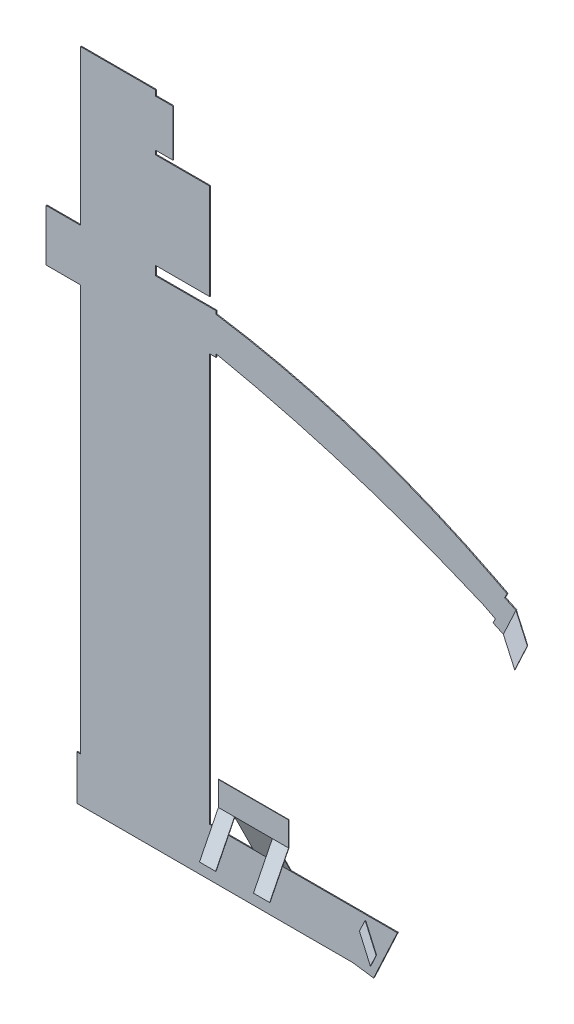
from build123d import *

# Parameters (mm, degrees)
SKETCH_1_W      = 19
SKETCH_1_H      = 52
SKETCH_1_W_2    = 60
SKETCH_1_H_2    = 60
SKETCH_1_H_3    = 106.4
SKETCH_1_H_4    = 111
SKETCH_1_H_5    = 111.3
SKETCH_1_H_6    = 112
SKETCH_1_H_7    = 113
SKETCH_1_H_8    = 116.5
SKETCH_1_H_9    = 131.6
EXTRUDE_1_DEPTH = 1
EXTRUDE_2_DEPTH = 1
EXTRUDE_3_DEPTH = 33.212704
SKETCH_4_W      = 0.5
SKETCH_4_H      = 27
EXTRUDE_4_DEPTH = 42
SKETCH_5_W      = 0.5
SKETCH_5_H      = 27
EXTRUDE_5_DEPTH = 18
EXTRUDE_6_DEPTH = 1
EXTRUDE_7_DEPTH = 15


with BuildPart() as part:
    # 草图1 → 拉伸1 (new body)
    with BuildSketch(Plane.XY):
        with Locations((858.7, -476.2)):
            Rectangle(SKETCH_1_W, SKETCH_1_H)
        Polygon((825.5, -1174.6), (825.5, -1125.1), (765.5, -1125.1), (761.5, -1125.1), (761.5, -1174.6), (765.5, -1174.6), align=None)
        Polygon((849.2, -1121.1), (909.2, -1121.1), (909.2, -1091.6), (909.2, -1064), (849.2, -1064), align=None)
        with Locations((795.5, -474.2)):
            Rectangle(SKETCH_1_W_2, SKETCH_1_H_2)
        with Locations((879.2, -559.9)):
            Rectangle(SKETCH_1_W_2, SKETCH_1_H_3)
        Polygon((909.2, -953.1), (849.2, -953.1), (849.2, -1050.1), (849.2, -1064), (909.2, -1064), align=None)
        with Locations((795.5, -953.1)):
            Rectangle(SKETCH_1_W_2, SKETCH_1_H_4)
        with Locations((795.5, -842.1)):
            Rectangle(SKETCH_1_W_2, SKETCH_1_H_4)
        with Locations((879.2, -897.45)):
            Rectangle(SKETCH_1_W_2, SKETCH_1_H_5)
        with Locations((795.5, -560.2)):
            Rectangle(SKETCH_1_W_2, SKETCH_1_H_6)
        with Locations((795.5, -730.1)):
            Rectangle(SKETCH_1_W_2, SKETCH_1_H_7)
        with Locations((795.5, -1066.85)):
            Rectangle(SKETCH_1_W_2, SKETCH_1_H_8)
        with Locations((879.2, -776)):
            Rectangle(SKETCH_1_W_2, SKETCH_1_H_9)
        Polygon((849.2, -1121.1), (909.2, -1121.1), (1031.2, -1121.1), (1031.2, -1174.6), (849.2, -1174.6), align=None)
        with BuildLine():
            Line((1213.4, -757.7), (1226.4, -727))
            ThreePointArc((1226.4, -727), (1075.34720829, -664.295577574), (916.2, -626.6))
            Line((916.2, -626.6), (916.2, -623.1))
            Line((916.2, -623.1), (849.2, -623.1))
            Line((849.2, -623.1), (849.2, -668.1))
            Line((849.2, -668.1), (849.2, -681.1))
            Line((849.2, -681.1), (849.2, -710.2))
            Line((849.2, -710.2), (909.2, -710.2))
            Line((909.2, -710.2), (909.2, -668.1))
            Line((909.2, -668.1), (916.2, -668.1))
            Line((916.2, -668.1), (916.2, -664.6))
            ThreePointArc((916.2, -664.6), (1067.153405165, -703.637303814), (1213.4, -757.7))
        make_face()
        Polygon((765.5, -616.2), (825.5, -616.2), (825.5, -504.2), (825.5, -444.2), (849.2, -444.2), (849.2, -450.2), (849.2, -502.2), (849.2, -506.7), (849.2, -613.1), (849.2, -623.1), (849.2, -668.1), (849.2, -681.1), (849.2, -710.2), (849.2, -841.8), (849.2, -953.1), (849.2, -1050.1), (849.2, -1064), (849.2, -1121.1), (849.2, -1174.6), (825.5, -1174.6), (825.5, -1125.1), (825.5, -1008.6), (825.5, -897.6), (825.5, -786.6), (825.5, -673.6), (765.5, -673.6), (727.5, -673.6), (727.5, -616.2), align=None)
    extrude(amount=-EXTRUDE_1_DEPTH)

    # 草图2 → 拉伸2 (add)
    with BuildSketch(Plane.XY):
        Polygon((1237.099840045, -739.006390924), (1239.746814184, -733.845622773), (1226.4, -727), (1213.4, -757.7), (1226.746814184, -764.545622773), (1224.14778512, -769.612913087), (1235.545483088, -774.927746934), (1249.581778451, -744.826814391), align=None)
    extrude(amount=-EXTRUDE_2_DEPTH)

    # 草图3 → 拉伸3 (add)
    with BuildSketch(Plane(origin=(-76.138469502, -163.279474765, 0), x_dir=(0.9063077870373919, -0.42261826173910827, 0), z_dir=(-0.42261826173910827, -0.9063077870373919, 0))):
        Polygon((1447.283109945, 0), (1477.783109945, 15), (1477.783109945, 14.5), (1447.283109945, -0.5), align=None)
    extrude(amount=-EXTRUDE_3_DEPTH)

    # 草图4 → 拉伸4 (add)
    with BuildSketch(Plane(origin=(999.7, -1174.6, 0), x_dir=(0, 0, -1), z_dir=(1, 0, 0))):
        with Locations((-20.608674231, 109)):
            Rectangle(SKETCH_4_W, SKETCH_4_H)
        Polygon((-20.858674231, 95.5), (0, 53.5), (0.5, 53.5), (-20.358674231, 95.5), align=None)
    extrude(amount=-EXTRUDE_4_DEPTH)

    # 草图5 → 拉伸5 (add)
    with BuildSketch(Plane(origin=(999.7, -1174.6, 0), x_dir=(0, 0, -1), z_dir=(1, 0, 0))):
        with Locations((-20.608674231, 109)):
            Rectangle(SKETCH_5_W, SKETCH_5_H)
        Polygon((-41.858674231, 53.5), (-41.358674231, 53.5), (-20.358674231, 95.5), (-20.858674231, 95.5), align=None)
    extrude_5 = extrude(amount=EXTRUDE_5_DEPTH)

    # 镜像1: 拉伸5 across plane
    add(extrude_5.mirror(Plane(origin=(978.7, -1174.6, 0), x_dir=(0, 0, 1), z_dir=(-1, 0, 0))))

    # 草图6 → 拉伸6 (add)
    with BuildSketch(Plane.XY):
        Polygon((1031.2, -1121.1), (1117.8, -1121.1), (1091.336296883, -1177.851594476), (1068.2, -1174.6), (1031.2, -1174.6), align=None)
    extrude(amount=-EXTRUDE_6_DEPTH)

    # 草图7 → 拉伸7 (add)
    with BuildSketch(Plane(origin=(1109.136325634, -1139.679309634, 0), x_dir=(0.9063077870366769, -0.422618261740642, 0), z_dir=(-0.422618261740642, -0.9063077870366769, 0))):
        Polygon((-30, -0.5), (0, 14.5), (0, 15), (-30, 0), align=None)
    extrude(amount=EXTRUDE_7_DEPTH)


solid = part.part
